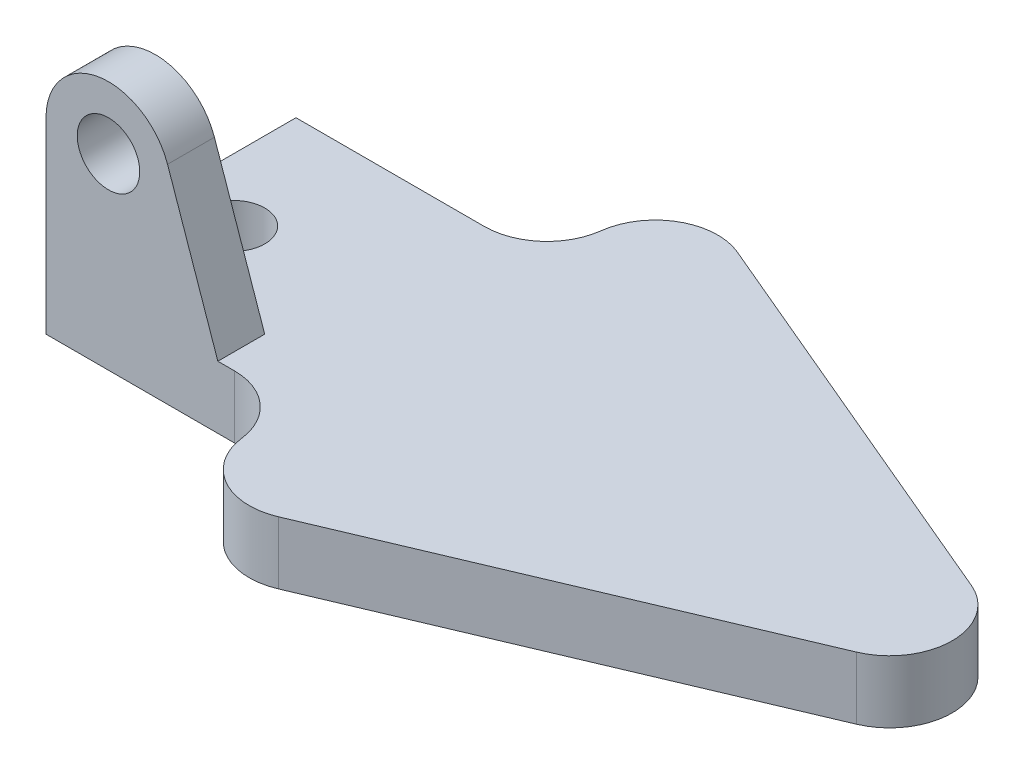
from build123d import *

# Parameters (mm, degrees)
SKETCH4_R           = 10
BOSS_EXTRUDE1_DEPTH = 20
SKETCH5_R           = 10
BOSS_EXTRUDE2_DEPTH = 15


with BuildPart() as part:
    # Sketch4 → Boss-Extrude1 (new body)
    with BuildSketch(Plane(origin=(0, 0, 0), x_dir=(1, 0, 0), z_dir=(0, 1, 0))):
        with BuildLine():
            Line((-77.28011811, -56.673598022), (-77.28011811, 23.326401978))
            Line((-77.28011811, 23.326401978), (-16.966387776, 23.326401978))
            ThreePointArc((-16.966387776, 23.326401978), (-3.737631221, 28.326401978), (2.876747057, 40.826401978))
            ThreePointArc((2.876747057, 40.826401978), (12.736944948, 55.656750215), (30.512681706, 56.745747))
            Line((30.512681706, 56.745747), (160.512681706, 1.745747))
            ThreePointArc((160.512681706, 1.745747), (172.71988189, -16.673598022), (160.512681706, -35.092943043))
            Line((160.512681706, -35.092943043), (30.512681706, -90.092943043))
            ThreePointArc((30.512681706, -90.092943043), (12.736944948, -89.003946259), (2.876747057, -74.173598022))
            ThreePointArc((2.876747057, -74.173598022), (-3.737631221, -61.673598022), (-16.966387776, -56.673598022))
            Line((-16.966387776, -56.673598022), (-77.28011811, -56.673598022))
        make_face()
        with Locations(Location((-57.28011811, -16.673598022, 0), (0, 0, 270))):
            Circle(SKETCH4_R, mode=Mode.SUBTRACT)
    extrude(amount=BOSS_EXTRUDE1_DEPTH)

    # Sketch5 → Boss-Extrude2 (add)
    with BuildSketch(Plane.XY.offset(56.673598022)):
        with BuildLine():
            Line((-77.28011811, 20), (-77.28011811, 60))
            ThreePointArc((-77.28011811, 60), (-60.595178298, 79.723345962), (-38.379080515, 66.538407896))
            Line((-38.379080515, 66.538407896), (-22.28011811, 20))
            Line((-22.28011811, 20), (-77.28011811, 20))
        make_face()
        with Locations((-57.28011811, 60)):
            Circle(SKETCH5_R, mode=Mode.SUBTRACT)
    extrude(amount=-BOSS_EXTRUDE2_DEPTH)


solid = part.part
